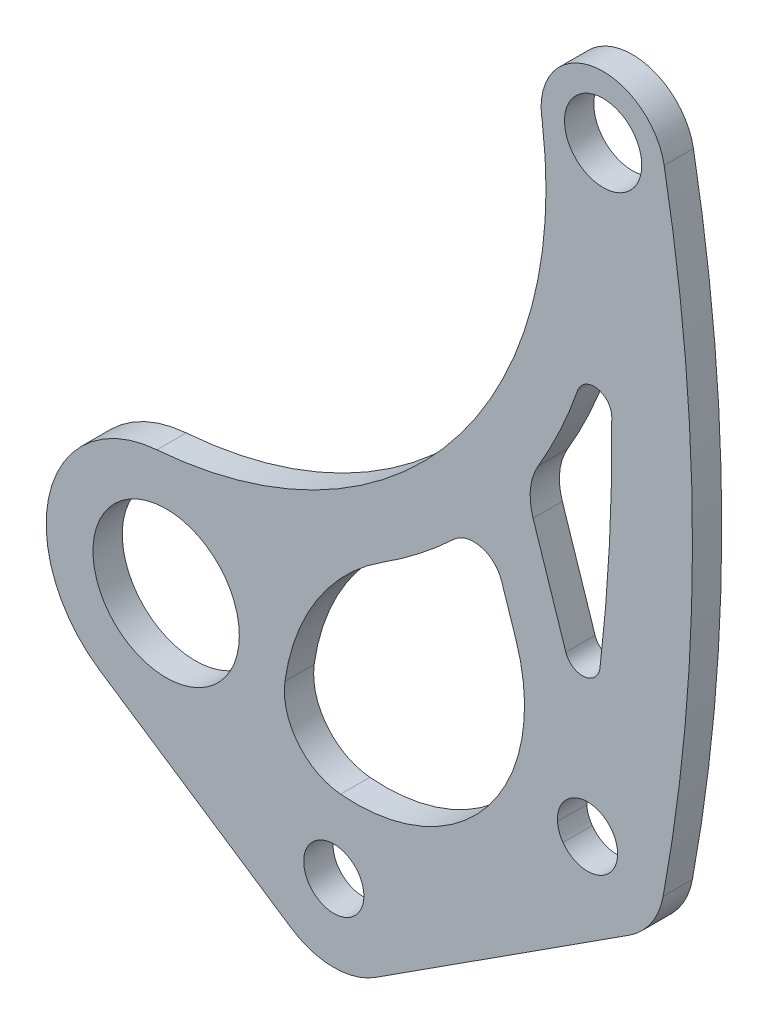
from build123d import *

# Parameters (mm, degrees)
SKETCH2_R           = 7.9375
SKETCH2_R_2         = 3.2639
SKETCH2_R_3         = 4.191
BOSS_EXTRUDE1_DEPTH = 3.175
FILLET3_R           = 1.905
FILLET4_R           = 6.35
BOSS_EXTRUDE2_START = -3.175
BOSS_EXTRUDE2_DEPTH = 3.175
CUT_EXTRUDE1_DEPTH  = 12.065
FILLET5_R           = 3.175


with BuildPart() as part:
    # Sketch2 → Boss-Extrude1 (new body)
    with BuildSketch(Plane.XY):
        with BuildLine():
            Line((22.709173353, -24.74146542), (50.237344688, -7.01528789))
            ThreePointArc((50.237344688, -7.01528789), (52.649254226, -4.648236557), (53.924522204, -1.51871084))
            ThreePointArc((53.924522204, -1.51871084), (57.106411985, 32.846575037), (54.035830718, 67.22198524))
            ThreePointArc((54.035830718, 67.22198524), (46.044632155, 72.608660166), (40.859194914, 64.485436554))
            Line((40.859194914, 64.485436554), (40.833827284, 64.453346951))
            ThreePointArc((40.833827284, 64.453346951), (30.975387354, 29.729811242), (-0.998479041, 12.979150429))
            ThreePointArc((-0.998479041, 12.979150429), (-12.595568055, 3.287395871), (-7.214067166, -10.835706769))
            Line((-7.214067166, -10.835706769), (13.567787564, -24.671601284))
            ThreePointArc((13.567787564, -24.671601284), (18.128061271, -26.069833859), (22.709173353, -24.74146542))
        make_face()
        Circle(SKETCH2_R, mode=Mode.SUBTRACT)
        with Locations((18.191828664, -17.726177531)):
            Circle(SKETCH2_R_2, mode=Mode.SUBTRACT)
        with Locations((45.72, 0)):
            Circle(SKETCH2_R_2, mode=Mode.SUBTRACT)
        with BuildLine():
            Line((40.584986991, 6.617553577), (21.318666843, -5.788581474))
            Line((21.318666843, -5.788581474), (11.074870198, -6.841239387))
            ThreePointArc((11.074870198, -6.841239387), (12.976194182, 1.036190528), (9.848859751, 8.512066016))
            ThreePointArc((9.848859751, 8.512066016), (23.445327069, 14.632175726), (34.749899024, 24.354640398))
            Line((34.749899024, 24.354640398), (40.584986991, 6.617553577))
        make_face(mode=Mode.SUBTRACT)
        with BuildLine():
            ThreePointArc((47.523781163, 56.501393309), (48.257752726, 32.370804269), (45.933946154, 8.34115665))
            Line((45.933946154, 8.34115665), (38.882442516, 29.775817606))
            ThreePointArc((38.882442516, 29.775817606), (45.039190515, 42.544935267), (47.523781163, 56.501393309))
        make_face(mode=Mode.SUBTRACT)
        with Locations((47.413333333, 66.018287029)):
            Circle(SKETCH2_R_3, mode=Mode.SUBTRACT)
    extrude(amount=BOSS_EXTRUDE1_DEPTH)

    # Fillet3
    fillet3_edges = [part.edges().sort_by_distance(p)[0] for p in [
        (45.933946154, 8.34115665, 1.5875),
        (47.523781163, 56.501393309, 1.5875),
    ]]
    fillet(fillet3_edges, radius=FILLET3_R)

    # Fillet4
    fillet4_edges = [part.edges().sort_by_distance(p)[0] for p in [
        (38.882442516, 29.775817606, 1.5875),
    ]]
    fillet(fillet4_edges, radius=FILLET4_R)

    # Sketch3 → Boss-Extrude2 (add)
    with BuildSketch(Plane.XY.offset(3.175).offset(BOSS_EXTRUDE2_START)):
        with BuildLine():
            ThreePointArc((37.967247274, 14.574773228), (38.850624387, 9.974362656), (38.539279751, 5.300264126))
            Line((38.539279751, 5.300264126), (40.584986991, 6.617553577))
            Line((40.584986991, 6.617553577), (37.967247274, 14.574773228))
        make_face()
        with BuildLine():
            ThreePointArc((14.005375904, -6.540099084), (13.004272705, -4.28056917), (12.890798124, -1.811802966))
            ThreePointArc((12.890798124, -1.811802966), (12.243860592, -4.42076736), (11.074870198, -6.841239387))
            Line((11.074870198, -6.841239387), (14.005375904, -6.540099084))
        make_face()
        with BuildLine():
            ThreePointArc((9.848859751, 8.512066016), (12.486736073, 3.679229335), (12.890798124, -1.811802966))
            ThreePointArc((12.890798124, -1.811802966), (16.379474961, 7.582660649), (23.480082515, 14.654307207))
            ThreePointArc((23.480082515, 14.654307207), (16.886076234, 11.091387544), (9.848859751, 8.512066016))
        make_face()
    extrude(amount=BOSS_EXTRUDE2_DEPTH)

    # Sketch4 → Cut-Extrude1 (cut)
    with BuildSketch(Plane.XY):
        with BuildLine():
            Line((38.539279751, 5.300264126), (24.727997063, 1.47053375))
            ThreePointArc((24.727997063, 1.47053375), (25.836206507, -0.508508416), (26.220294441, -2.743953008))
            ThreePointArc((26.220294441, -2.743953008), (24.044282761, -7.68479904), (18.930249644, -9.41501626))
            ThreePointArc((18.930249644, -9.41501626), (30.477911362, -6.56779892), (37.848176473, 2.766778194))
            ThreePointArc((37.848176473, 2.766778194), (38.239149826, 4.021130685), (38.539279751, 5.300264126))
        make_face()
        with BuildLine():
            ThreePointArc((24.727997063, 1.47053375), (17.733373474, 3.709866579), (12.890798123, -1.811802972))
            Line((12.890798123, -1.811802972), (24.727997063, 1.47053375))
        make_face()
        with BuildLine():
            Line((24.727997063, 1.47053375), (12.890798123, -1.811802972))
            ThreePointArc((12.890798123, -1.811802972), (14.27873169, -6.909589201), (18.930249644, -9.41501626))
            ThreePointArc((18.930249644, -9.41501626), (24.044282761, -7.68479904), (26.220294441, -2.743953008))
            ThreePointArc((26.220294441, -2.743953008), (25.836206507, -0.508508416), (24.727997063, 1.47053375))
        make_face()
    extrude(amount=CUT_EXTRUDE1_DEPTH, mode=Mode.SUBTRACT)

    # Fillet5
    fillet5_edges = [part.edges().sort_by_distance(p)[0] for p in [
        (34.749899024, 24.354640398, 1.5875),
    ]]
    fillet(fillet5_edges, radius=FILLET5_R)


solid = part.part
